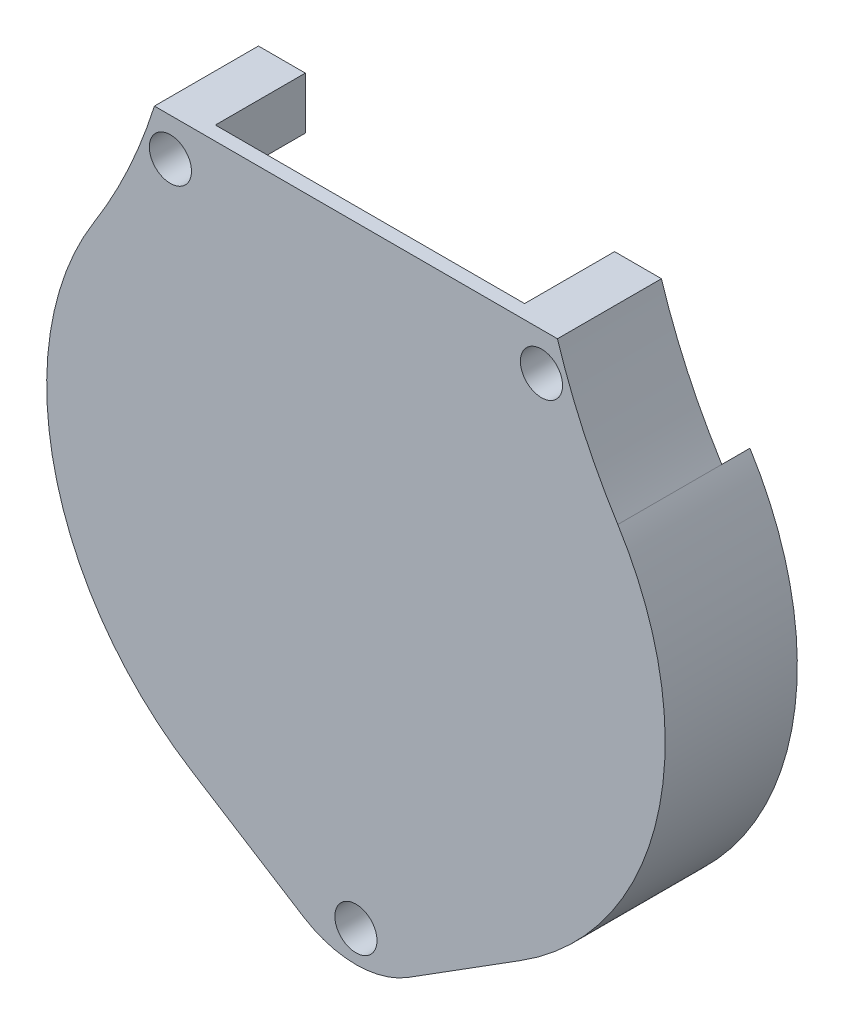
from build123d import *

# Parameters (mm, degrees)
BOSS_EXTRUDE1_DEPTH = 11.938
CUT_EXTRUDE1_DEPTH  = 11.43
SKETCH3_W           = 27.94
SKETCH3_H           = 25.845942769
CUT_EXTRUDE2_DEPTH  = 10.668
SKETCH4_R           = 1.905
CUT_EXTRUDE3_DEPTH  = 8.636
SKETCH5_R           = 1.143
CUT_EXTRUDE4_DEPTH  = 21.59
CUT_EXTRUDE5_DEPTH  = 2.54


with BuildPart() as part:
    # Sketch1 → Boss-Extrude1 (new body)
    with BuildSketch(Plane.XY):
        with BuildLine():
            Line((-4.737825132, -30.035944056), (-14.890307558, -23.641538462))
            ThreePointArc((-14.890307558, -23.641538462), (-27.242520167, -6.203925768), (-23.658870968, 14.862752926))
            ThreePointArc((-23.658870968, 14.862752926), (-20.55370118, 20.591203739), (-18.20732863, 26.67))
            Line((-18.20732863, 26.67), (18.20732863, 26.67))
            ThreePointArc((18.20732863, 26.67), (20.55370118, 20.591203739), (23.658870968, 14.862752926))
            ThreePointArc((23.658870968, 14.862752926), (27.242520167, -6.203925768), (14.890307558, -23.641538462))
            Line((14.890307558, -23.641538462), (4.737825132, -30.035944056))
            ThreePointArc((4.737825132, -30.035944056), (0, -31.403636364), (-4.737825132, -30.035944056))
        make_face()
    extrude(amount=BOSS_EXTRUDE1_DEPTH)

    # Sketch2 → Cut-Extrude1 (cut)
    with BuildSketch(Plane(origin=(0, 0, 0), x_dir=(-1, 0, 0), z_dir=(0, 0, -1))):
        with BuildLine():
            Line((-11.733590414, 23.241), (11.733590414, 23.241))
            ThreePointArc((11.733590414, 23.241), (0, -26.035), (-11.733590414, 23.241))
        make_face()
    extrude(amount=-CUT_EXTRUDE1_DEPTH, mode=Mode.SUBTRACT)

    # Sketch3 → Cut-Extrude2 (cut)
    with BuildSketch(Plane(origin=(0, 0, 0), x_dir=(-1, 0, 0), z_dir=(0, 0, -1))):
        with Locations((0, 24.280777857)):
            Rectangle(SKETCH3_W, SKETCH3_H)
    extrude(amount=-CUT_EXTRUDE2_DEPTH, mode=Mode.SUBTRACT)

    # Sketch4 → Cut-Extrude3 (cut)
    with BuildSketch(Plane.XY.offset(11.938)):
        with Locations((0, -28.575)):
            Circle(SKETCH4_R)
        with Locations((-16.764, 23.241)):
            Circle(SKETCH4_R)
        with Locations((16.764, 23.241)):
            Circle(SKETCH4_R)
    extrude(amount=-CUT_EXTRUDE3_DEPTH, mode=Mode.SUBTRACT)

    # Sketch5 → Cut-Extrude4 (cut)
    with BuildSketch(Plane.XY.offset(3.302)):
        with Locations((-16.764, 23.241)):
            Circle(SKETCH5_R)
        with Locations((16.764, 23.241)):
            Circle(SKETCH5_R)
        with Locations((0, -28.575)):
            Circle(SKETCH5_R)
    extrude(amount=-CUT_EXTRUDE4_DEPTH, mode=Mode.SUBTRACT)

    # Sketch6 → Cut-Extrude5 (cut)
    with BuildSketch(Plane(origin=(0, 0, 0), x_dir=(-1, 0, 0), z_dir=(0, 0, -1))):
        with BuildLine():
            Line((-23.658870968, 14.862752926), (-4.737825132, -30.035944056))
            ThreePointArc((-4.737825132, -30.035944056), (0, -31.403636364), (4.737825132, -30.035944056))
            Line((4.737825132, -30.035944056), (23.658870968, 14.862752926))
            ThreePointArc((23.658870968, 14.862752926), (20.55370118, 20.591203739), (18.20732863, 26.67))
            Line((18.20732863, 26.67), (-18.20732863, 26.67))
            ThreePointArc((-18.20732863, 26.67), (-20.55370118, 20.591203739), (-23.658870968, 14.862752926))
        make_face()
    extrude(amount=-CUT_EXTRUDE5_DEPTH, mode=Mode.SUBTRACT)


solid = part.part
